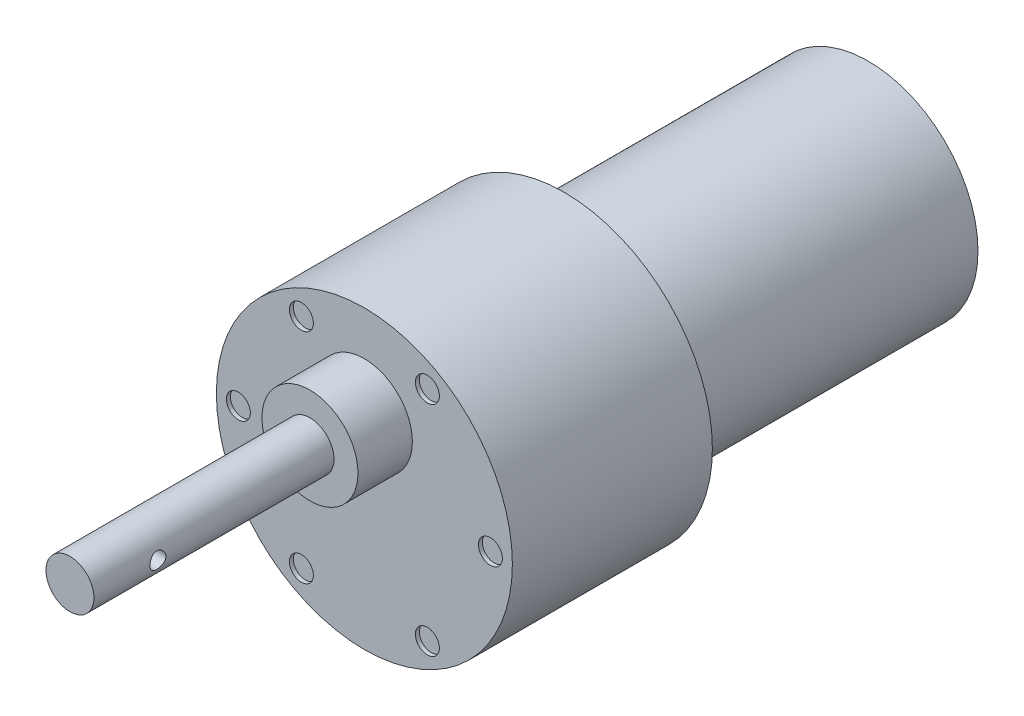
from build123d import *

# Parameters (mm, degrees)
SKETCH1_R               = 13.7
BOSS_EXTRUDE1_DEPTH     = 38
SKETCH2_R               = 18.5
BOSS_EXTRUDE2_DEPTH     = 25
SKETCH3_R               = 6
BOSS_EXTRUDE3_DEPTH     = 6.8
SKETCH4_R               = 3
BOSS_EXTRUDE4_DEPTH     = 30
SKETCH5_R               = 1.5
CUT_EXTRUDE1_DEPTH      = 0.5
CUT_EXTRUDE2_DEPTH      = 104.172380025
CUT_EXTRUDE2_DEPTH_BACK = 104.172380025
SKETCH6_R               = 1


with BuildPart() as part:
    # Sketch1 → Boss-Extrude1 (new body)
    with BuildSketch(Plane.XY):
        Circle(SKETCH1_R)
    extrude(amount=BOSS_EXTRUDE1_DEPTH)

    # Sketch2 → Boss-Extrude2 (add)
    with BuildSketch(Plane.XY.offset(38)):
        Circle(SKETCH2_R)
    extrude(amount=BOSS_EXTRUDE2_DEPTH)

    # Sketch3 → Boss-Extrude3 (add)
    with BuildSketch(Plane.XY.offset(63)):
        with Locations((0, 7)):
            Circle(SKETCH3_R)
    extrude(amount=BOSS_EXTRUDE3_DEPTH)

    # Sketch4 → Boss-Extrude4 (add)
    with BuildSketch(Plane.XY.offset(69.8)):
        with Locations((0, 7)):
            Circle(SKETCH4_R)
    extrude(amount=BOSS_EXTRUDE4_DEPTH)

    # Sketch5 → Cut-Extrude1 (cut)
    with BuildSketch(Plane.XY.offset(63)):
        with Locations((-15.75, 0)):
            Circle(SKETCH5_R)
        with Locations((-7.875, 13.63990011)):
            Circle(SKETCH5_R)
        with Locations((7.875, 13.63990011)):
            Circle(SKETCH5_R)
        with Locations((15.75, 0)):
            Circle(SKETCH5_R)
        with Locations((7.875, -13.63990011)):
            Circle(SKETCH5_R)
        with Locations((-7.875, -13.63990011)):
            Circle(SKETCH5_R)
    extrude(amount=-CUT_EXTRUDE1_DEPTH, mode=Mode.SUBTRACT)

    # Sketch6 → Cut-Extrude2 (cut, two sides: drawn at the far end of the back side and taken through both)
    with BuildSketch(Plane(origin=(0, 0, 0), x_dir=(0, 0, -1), z_dir=(1, 0, 0)).offset(-CUT_EXTRUDE2_DEPTH_BACK)):
        with Locations(Location((-91.8, 7, 0), (0, 0, 180))):
            Circle(SKETCH6_R)
    extrude(amount=CUT_EXTRUDE2_DEPTH + CUT_EXTRUDE2_DEPTH_BACK, mode=Mode.SUBTRACT)


solid = part.part
